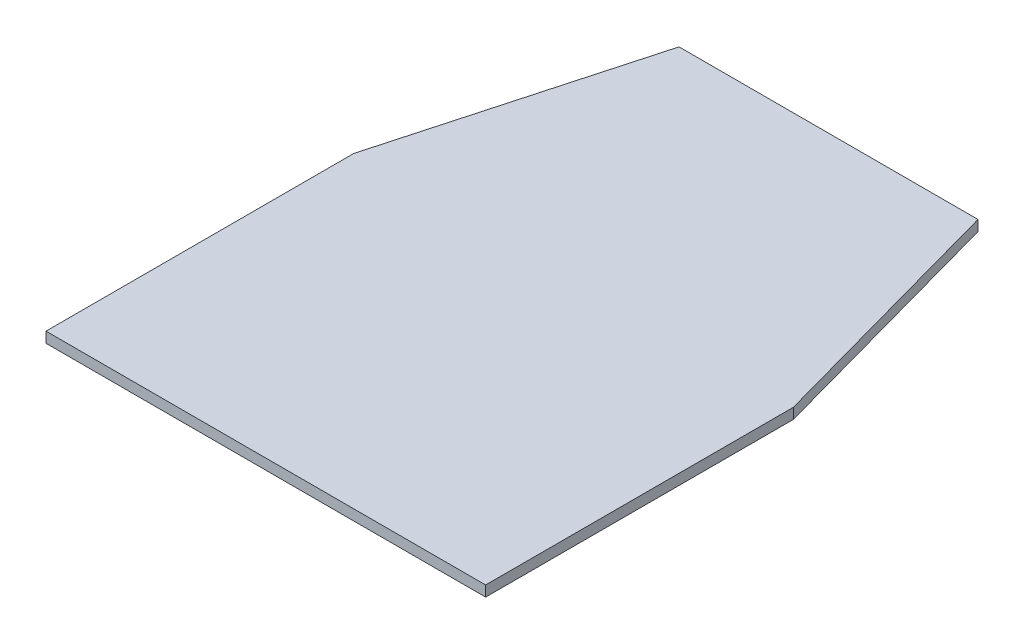
from build123d import *

# Parameters (mm, degrees)
BOSS_EXTRUDE1_DEPTH = 6


with BuildPart() as part:
    # Sketch1 → Boss-Extrude1 (new body)
    with BuildSketch(Plane(origin=(0, 0, 0), x_dir=(1, 0, 0), z_dir=(0, 1, 0))):
        Polygon((0, 0), (250, 0), (250, 175), (210, 320), (40, 320), (0, 175), align=None)
    extrude(amount=BOSS_EXTRUDE1_DEPTH)


solid = part.part
